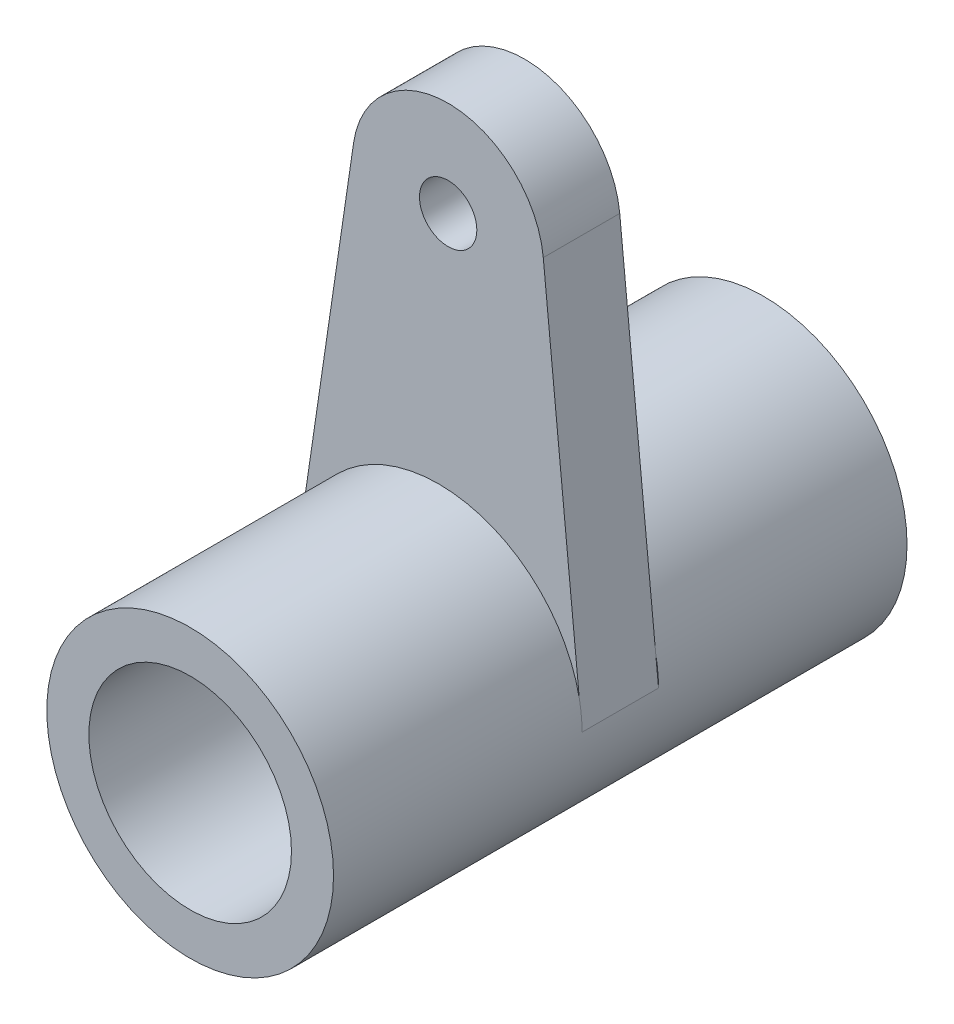
from build123d import *

# Parameters (mm, degrees)
BOSS_EXTRU_2_DEPTH      = 2
BOSS_EXTRU_2_DEPTH_BACK = 2
ESQUISSE1_R             = 5.3
ESQUISSE1_R_2           = 1.5
ESQUISSE2_R             = 7.5
ESQUISSE2_R_2           = 5.3
BOSS_EXTRU_3_DEPTH      = 13


with BuildPart() as part:
    # Esquisse1 → Boss.-Extru.2 (new, two sides: drawn at the far end of the back side and taken through both)
    with BuildSketch(Plane.XY.offset(-BOSS_EXTRU_2_DEPTH_BACK)):
        with BuildLine():
            ThreePointArc((-7.5, 0), (0, -7.5), (7.5, 0))
            Line((7.5, 0), (5.471395589, 20.4865521))
            ThreePointArc((5.471395589, 20.4865521), (0.614199015, 24.992451663), (-4.451008104, 20.721717969))
            Line((-4.451008104, 20.721717969), (-7.5, 0))
        make_face()
        Circle(ESQUISSE1_R, mode=Mode.SUBTRACT)
        with Locations((0.495729813, 19.993855355)):
            Circle(ESQUISSE1_R_2, mode=Mode.SUBTRACT)
    extrude(amount=BOSS_EXTRU_2_DEPTH + BOSS_EXTRU_2_DEPTH_BACK)

    # Esquisse2 → Boss.-Extru.3 (add)
    with BuildSketch(Plane.XY.offset(2)):
        Circle(ESQUISSE2_R)
        Circle(ESQUISSE2_R_2, mode=Mode.SUBTRACT)
    boss_extru_3 = extrude(amount=BOSS_EXTRU_3_DEPTH)

    # Symétrie1: Boss.-Extru.3 across plane
    add(boss_extru_3.mirror(Plane.XY))


solid = part.part
